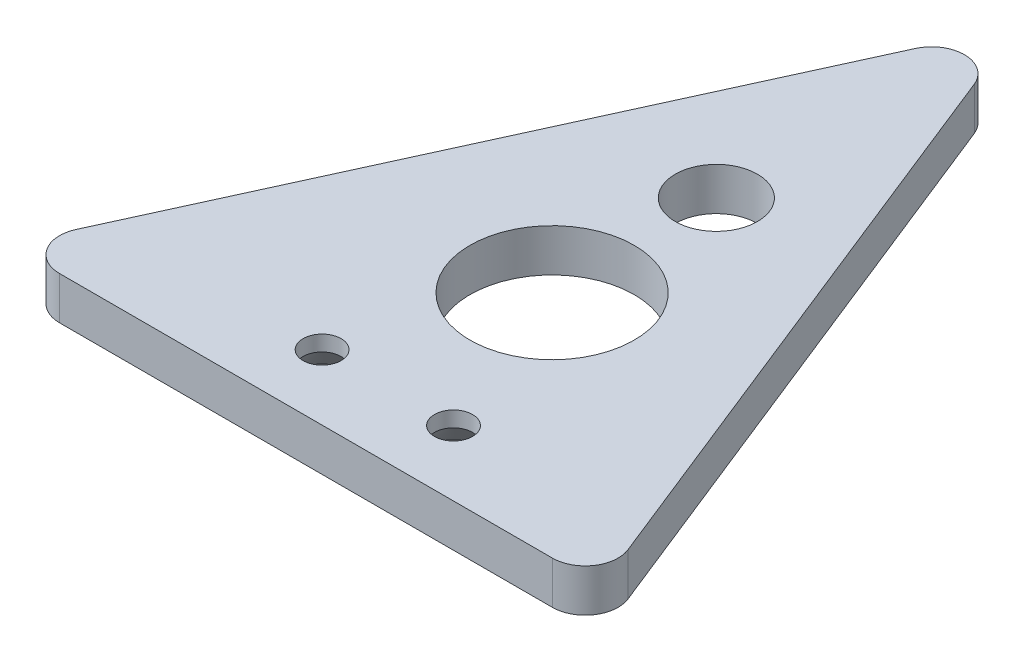
from build123d import *

# Parameters (mm, degrees)
SKETCH1_R                      = 1.1303
BOSS_EXTRUDE1_DEPTH            = 3.302
F_4_CLEARANCE_HOLE1_AT_2_COUNT = 2
F_4_CLEARANCE_HOLE1_AT_2_PITCH = 10.16
SKETCH17_R                     = 6.35
CUT_EXTRUDE1_DEPTH             = 52.411789825
SKETCH18_R                     = 3.175
CUT_EXTRUDE2_DEPTH             = 52.411789825


with BuildPart() as part:
    # Sketch1 → Boss-Extrude1 (new body)
    with BuildSketch(Plane(origin=(0, 0, 0), x_dir=(1, 0, 0), z_dir=(0, 1, 0))):
        with BuildLine():
            Line((7.439072116, 42.978476899), (25.219072116, -1.573123101))
            ThreePointArc((25.219072116, -1.573123101), (24.962730525, -3.939424318), (22.86, -5.0546))
            Line((22.86, -5.0546), (-15.24, -5.0546))
            ThreePointArc((-15.24, -5.0546), (-17.37645185, -3.888344332), (-17.550975292, -1.460563379))
            Line((-17.550975292, -1.460563379), (2.769024708, 43.091036621))
            ThreePointArc((2.769024708, 43.091036621), (5.141202523, 44.576262541), (7.439072116, 42.978476899))
        make_face()
        with Locations(Location((0, 0, 0), (0, 0, 90))):
            Circle(SKETCH1_R, mode=Mode.SUBTRACT)
        with Locations(Location((10.16, 0, 0), (0, 0, 90))):
            Circle(SKETCH1_R, mode=Mode.SUBTRACT)
    extrude(amount=BOSS_EXTRUDE1_DEPTH)

    # Sketch16 → #4 Clearance Hole1 (revolve, cut)
    with BuildSketch(Plane(origin=(0, 0, 0), x_dir=(0, 0, -1), z_dir=(1, 0, 0))):
        Polygon((0, 0), (0, 3.302), (1.4732, 3.302), (1.4732, 2.103793743), (3.302, 0), align=None)
    f_4_clearance_hole1 = revolve(axis=Axis((0, -6.35, 0), (0, 1, 0)), mode=Mode.SUBTRACT)

    # #4 Clearance Hole1 at 2: #4 Clearance Hole1 ×2
    with Locations(*[(i * F_4_CLEARANCE_HOLE1_AT_2_PITCH, 0, 0) for i in range(1, F_4_CLEARANCE_HOLE1_AT_2_COUNT)]):
        add(f_4_clearance_hole1, mode=Mode.SUBTRACT)

    # Sketch17 → Cut-Extrude1 (cut, through all)
    with BuildSketch(Plane.XZ):
        with Locations(Location((5.08, -12.7, 0), (0, 0, 270))):
            Circle(SKETCH17_R)
    extrude(amount=-CUT_EXTRUDE1_DEPTH, mode=Mode.SUBTRACT)

    # Sketch18 → Cut-Extrude2 (cut, through all)
    with BuildSketch(Plane.XZ):
        with Locations(Location((5.08, -25.4, 0), (0, 0, 270))):
            Circle(SKETCH18_R)
    extrude(amount=-CUT_EXTRUDE2_DEPTH, mode=Mode.SUBTRACT)


solid = part.part
